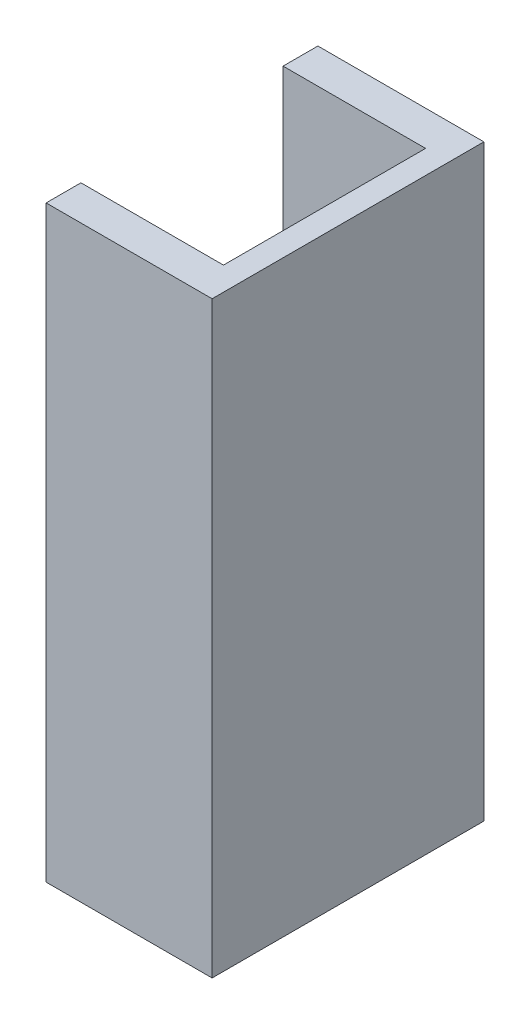
from build123d import *

# Parameters (mm, degrees)
BOSS_EXTRUDE1_DEPTH = 110


with BuildPart() as part:
    # Sketch1 → Boss-Extrude1 (new body)
    with BuildSketch(Plane(origin=(0, 0, 0), x_dir=(1, 0, 0), z_dir=(0, 1, 0))):
        Polygon((23.29, 25.41), (-7.75, 25.41), (-7.75, 18.9), (18.9, 18.9), (18.9, -18.9), (-7.75, -18.9), (-7.75, -25.41), (23.29, -25.41), align=None)
    extrude(amount=-BOSS_EXTRUDE1_DEPTH)


solid = part.part
